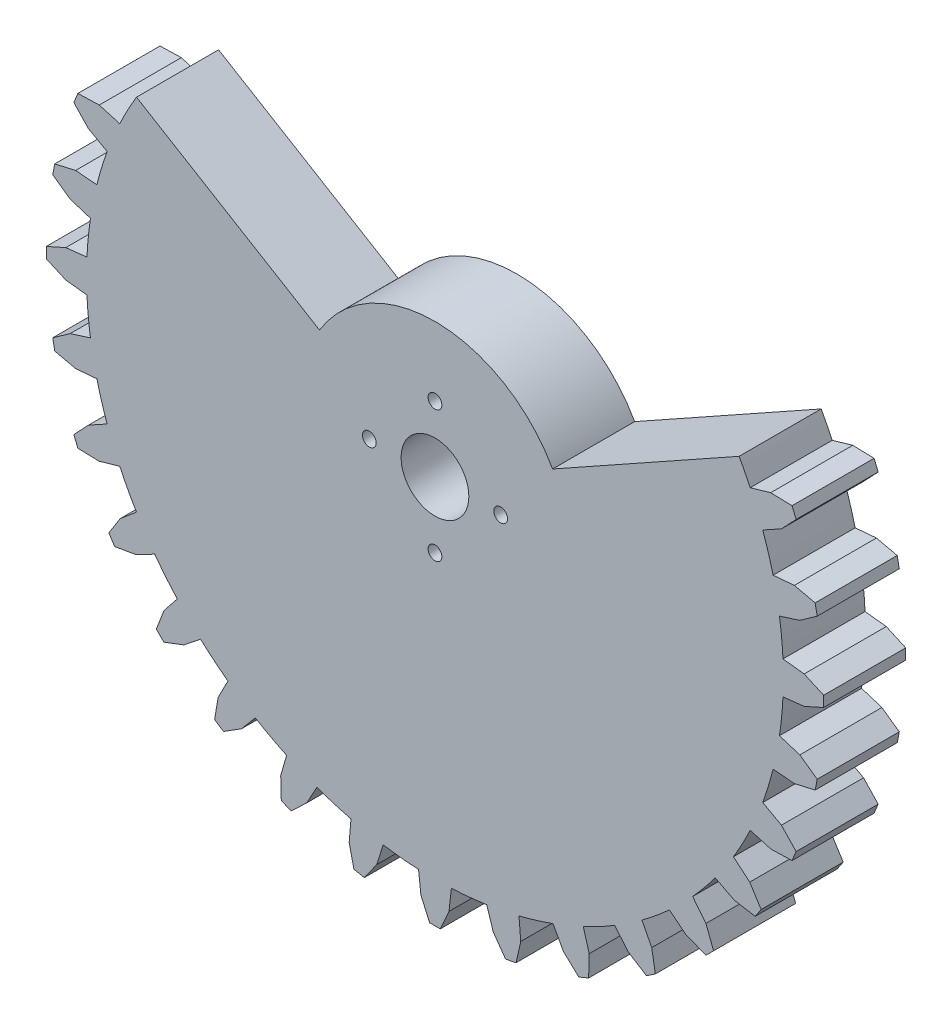
from build123d import *

# Parameters (mm, degrees)
BOSS_EXTRU_1_DEPTH      = 10
ESQUISSE2_R             = 0.838714544
ESQUISSE2_R_2           = 4.125
ENL_V_MAT_EXTRU_3_DEPTH = 10
ENL_V_MAT_EXTRU_6_DEPTH = 10


with BuildPart() as part:
    # Esquisse1 → Boss.-Extru.1 (new body)
    with BuildSketch(Plane.XY):
        with BuildLine():
            Line((-2, 42.397854014), (-1.710180776, 44.981650604))
            Line((-1.710180776, 44.981650604), (-0.65, 47.355680242))
            Line((-0.65, 47.355680242), (0.65, 47.355680242))
            Line((0.65, 47.355680242), (1.710180776, 44.981650604))
            Line((1.710180776, 44.981650604), (2, 42.397854014))
            ThreePointArc((2, 42.397854014), (4.160337521, 42.240615724), (6.309840432, 41.973371782))
            Line((6.309840432, 41.973371782), (7.098164569, 44.450980519))
            Line((7.098164569, 44.450980519), (8.601124475, 46.572562834))
            Line((8.601124475, 46.572562834), (9.87614534, 46.318945415))
            Line((9.87614534, 46.318945415), (10.452804833, 43.783701082))
            Line((10.452804833, 43.783701082), (10.232981553, 41.193010494))
            ThreePointArc((10.232981553, 41.193010494), (12.321133126, 40.61733255), (14.377197234, 39.935876411))
            Line((14.377197234, 39.935876411), (15.63373143, 42.212084181))
            Line((15.63373143, 42.212084181), (17.521712561, 43.999687955))
            Line((17.521712561, 43.999687955), (18.722755953, 43.502199493))
            Line((18.722755953, 43.502199493), (18.793733463, 40.903168482))
            Line((18.793733463, 40.903168482), (18.072715364, 38.405142681))
            ThreePointArc((18.072715364, 38.405142681), (20.008434495, 37.433148065), (21.89204641, 36.363667706))
            Line((21.89204641, 36.363667706), (23.568502761, 38.351001121))
            Line((23.568502761, 38.351001121), (25.768951059, 39.735929742))
            Line((25.768951059, 39.735929742), (26.849861555, 39.01368844))
            Line((26.849861555, 39.01368844), (26.412429455, 36.450750056))
            Line((26.412429455, 36.450750056), (25.217924859, 34.141386774))
            ThreePointArc((25.217924859, 34.141386774), (26.926822946, 32.810428693), (28.565596519, 31.394023643))
            Line((28.565596519, 31.394023643), (30.597549747, 33.016110595))
            Line((30.597549747, 33.016110595), (33.025903219, 33.945142034))
            Line((33.025903219, 33.945142034), (33.945142034, 33.025903219))
            Line((33.945142034, 33.025903219), (33.016110595, 30.597549747))
            Line((33.016110595, 30.597549747), (31.394023643, 28.565596519))
            ThreePointArc((31.394023643, 28.565596519), (32.810428693, 26.926822946), (34.141386774, 25.217924859))
            Line((34.141386774, 25.217924859), (36.450750056, 26.412429455))
            Line((36.450750056, 26.412429455), (39.01368844, 26.849861555))
            Line((39.01368844, 26.849861555), (39.735929742, 25.768951059))
            Line((39.735929742, 25.768951059), (38.351001121, 23.568502761))
            Line((38.351001121, 23.568502761), (36.363667706, 21.89204641))
            ThreePointArc((36.363667706, 21.89204641), (37.433148065, 20.008434495), (38.405142681, 18.072715364))
            Line((38.405142681, 18.072715364), (40.903168482, 18.793733463))
            Line((40.903168482, 18.793733463), (43.502199493, 18.722755953))
            Line((43.502199493, 18.722755953), (43.999687955, 17.521712561))
            Line((43.999687955, 17.521712561), (42.212084181, 15.63373143))
            Line((42.212084181, 15.63373143), (39.935876411, 14.377197234))
            ThreePointArc((39.935876411, 14.377197234), (40.61733255, 12.321133126), (41.193010494, 10.232981553))
            Line((41.193010494, 10.232981553), (43.783701082, 10.452804833))
            Line((43.783701082, 10.452804833), (46.318945415, 9.87614534))
            Line((46.318945415, 9.87614534), (46.572562834, 8.601124475))
            Line((46.572562834, 8.601124475), (44.450980519, 7.098164569))
            Line((44.450980519, 7.098164569), (41.973371782, 6.309840432))
            ThreePointArc((41.973371782, 6.309840432), (42.240615724, 4.160337521), (42.397854014, 2))
            Line((42.397854014, 2), (44.981650604, 1.710180776))
            Line((44.981650604, 1.710180776), (47.355680242, 0.65))
            Line((47.355680242, 0.65), (47.355680242, -0.65))
            Line((47.355680242, -0.65), (44.981650604, -1.710180776))
            Line((44.981650604, -1.710180776), (42.397854014, -2))
            ThreePointArc((42.397854014, -2), (42.240615724, -4.160337521), (41.973371782, -6.309840432))
            Line((41.973371782, -6.309840432), (44.450980519, -7.098164569))
            Line((44.450980519, -7.098164569), (46.572562834, -8.601124475))
            Line((46.572562834, -8.601124475), (46.318945415, -9.87614534))
            Line((46.318945415, -9.87614534), (43.783701082, -10.452804833))
            Line((43.783701082, -10.452804833), (41.193010494, -10.232981553))
            ThreePointArc((41.193010494, -10.232981553), (40.61733255, -12.321133126), (39.935876411, -14.377197234))
            Line((39.935876411, -14.377197234), (42.212084181, -15.63373143))
            Line((42.212084181, -15.63373143), (43.999687955, -17.521712561))
            Line((43.999687955, -17.521712561), (43.502199493, -18.722755953))
            Line((43.502199493, -18.722755953), (40.903168482, -18.793733463))
            Line((40.903168482, -18.793733463), (38.405142681, -18.072715364))
            ThreePointArc((38.405142681, -18.072715364), (37.433148065, -20.008434495), (36.363667706, -21.89204641))
            Line((36.363667706, -21.89204641), (38.351001121, -23.568502761))
            Line((38.351001121, -23.568502761), (39.735929742, -25.768951059))
            Line((39.735929742, -25.768951059), (39.01368844, -26.849861555))
            Line((39.01368844, -26.849861555), (36.450750056, -26.412429455))
            Line((36.450750056, -26.412429455), (34.141386774, -25.217924859))
            ThreePointArc((34.141386774, -25.217924859), (32.810428693, -26.926822946), (31.394023643, -28.565596519))
            Line((31.394023643, -28.565596519), (33.016110595, -30.597549747))
            Line((33.016110595, -30.597549747), (33.945142034, -33.025903219))
            Line((33.945142034, -33.025903219), (33.025903219, -33.945142034))
            Line((33.025903219, -33.945142034), (30.597549747, -33.016110595))
            Line((30.597549747, -33.016110595), (28.565596519, -31.394023643))
            ThreePointArc((28.565596519, -31.394023643), (26.926822946, -32.810428693), (25.217924859, -34.141386774))
            Line((25.217924859, -34.141386774), (26.412429455, -36.450750056))
            Line((26.412429455, -36.450750056), (26.849861555, -39.01368844))
            Line((26.849861555, -39.01368844), (25.768951059, -39.735929742))
            Line((25.768951059, -39.735929742), (23.568502761, -38.351001121))
            Line((23.568502761, -38.351001121), (21.89204641, -36.363667706))
            ThreePointArc((21.89204641, -36.363667706), (20.008434495, -37.433148065), (18.072715364, -38.405142681))
            Line((18.072715364, -38.405142681), (18.793733463, -40.903168482))
            Line((18.793733463, -40.903168482), (18.722755953, -43.502199493))
            Line((18.722755953, -43.502199493), (17.521712561, -43.999687955))
            Line((17.521712561, -43.999687955), (15.63373143, -42.212084181))
            Line((15.63373143, -42.212084181), (14.377197234, -39.935876411))
            ThreePointArc((14.377197234, -39.935876411), (12.321133126, -40.61733255), (10.232981553, -41.193010494))
            Line((10.232981553, -41.193010494), (10.452804833, -43.783701082))
            Line((10.452804833, -43.783701082), (9.87614534, -46.318945415))
            Line((9.87614534, -46.318945415), (8.601124475, -46.572562834))
            Line((8.601124475, -46.572562834), (7.098164569, -44.450980519))
            Line((7.098164569, -44.450980519), (6.309840432, -41.973371782))
            ThreePointArc((6.309840432, -41.973371782), (4.160337521, -42.240615724), (2, -42.397854014))
            Line((2, -42.397854014), (1.710180776, -44.981650604))
            Line((1.710180776, -44.981650604), (0.65, -47.355680242))
            Line((0.65, -47.355680242), (-0.65, -47.355680242))
            Line((-0.65, -47.355680242), (-1.710180776, -44.981650604))
            Line((-1.710180776, -44.981650604), (-2, -42.397854014))
            ThreePointArc((-2, -42.397854014), (-4.160337521, -42.240615724), (-6.309840432, -41.973371782))
            Line((-6.309840432, -41.973371782), (-7.098164569, -44.450980519))
            Line((-7.098164569, -44.450980519), (-8.601124475, -46.572562834))
            Line((-8.601124475, -46.572562834), (-9.87614534, -46.318945415))
            Line((-9.87614534, -46.318945415), (-10.452804833, -43.783701082))
            Line((-10.452804833, -43.783701082), (-10.232981553, -41.193010494))
            ThreePointArc((-10.232981553, -41.193010494), (-12.321133126, -40.61733255), (-14.377197234, -39.935876411))
            Line((-14.377197234, -39.935876411), (-15.63373143, -42.212084181))
            Line((-15.63373143, -42.212084181), (-17.521712561, -43.999687955))
            Line((-17.521712561, -43.999687955), (-18.722755953, -43.502199493))
            Line((-18.722755953, -43.502199493), (-18.793733463, -40.903168482))
            Line((-18.793733463, -40.903168482), (-18.072715364, -38.405142681))
            ThreePointArc((-18.072715364, -38.405142681), (-20.008434495, -37.433148065), (-21.89204641, -36.363667706))
            Line((-21.89204641, -36.363667706), (-23.568502761, -38.351001121))
            Line((-23.568502761, -38.351001121), (-25.768951059, -39.735929742))
            Line((-25.768951059, -39.735929742), (-26.849861555, -39.01368844))
            Line((-26.849861555, -39.01368844), (-26.412429455, -36.450750056))
            Line((-26.412429455, -36.450750056), (-25.217924859, -34.141386774))
            ThreePointArc((-25.217924859, -34.141386774), (-26.926822946, -32.810428693), (-28.565596519, -31.394023643))
            Line((-28.565596519, -31.394023643), (-30.597549747, -33.016110595))
            Line((-30.597549747, -33.016110595), (-33.025903219, -33.945142034))
            Line((-33.025903219, -33.945142034), (-33.945142034, -33.025903219))
            Line((-33.945142034, -33.025903219), (-33.016110595, -30.597549747))
            Line((-33.016110595, -30.597549747), (-31.394023643, -28.565596519))
            ThreePointArc((-31.394023643, -28.565596519), (-32.810428693, -26.926822946), (-34.141386774, -25.217924859))
            Line((-34.141386774, -25.217924859), (-36.450750056, -26.412429455))
            Line((-36.450750056, -26.412429455), (-39.01368844, -26.849861555))
            Line((-39.01368844, -26.849861555), (-39.735929742, -25.768951059))
            Line((-39.735929742, -25.768951059), (-38.351001121, -23.568502761))
            Line((-38.351001121, -23.568502761), (-36.363667706, -21.89204641))
            ThreePointArc((-36.363667706, -21.89204641), (-37.433148065, -20.008434495), (-38.405142681, -18.072715364))
            Line((-38.405142681, -18.072715364), (-40.903168482, -18.793733463))
            Line((-40.903168482, -18.793733463), (-43.502199493, -18.722755953))
            Line((-43.502199493, -18.722755953), (-43.999687955, -17.521712561))
            Line((-43.999687955, -17.521712561), (-42.212084181, -15.63373143))
            Line((-42.212084181, -15.63373143), (-39.935876411, -14.377197234))
            ThreePointArc((-39.935876411, -14.377197234), (-40.61733255, -12.321133126), (-41.193010494, -10.232981553))
            Line((-41.193010494, -10.232981553), (-43.783701082, -10.452804833))
            Line((-43.783701082, -10.452804833), (-46.318945415, -9.87614534))
            Line((-46.318945415, -9.87614534), (-46.572562834, -8.601124475))
            Line((-46.572562834, -8.601124475), (-44.450980519, -7.098164569))
            Line((-44.450980519, -7.098164569), (-41.973371782, -6.309840432))
            ThreePointArc((-41.973371782, -6.309840432), (-42.240615724, -4.160337521), (-42.397854014, -2))
            Line((-42.397854014, -2), (-44.981650604, -1.710180776))
            Line((-44.981650604, -1.710180776), (-47.355680242, -0.65))
            Line((-47.355680242, -0.65), (-47.355680242, 0.65))
            Line((-47.355680242, 0.65), (-44.981650604, 1.710180776))
            Line((-44.981650604, 1.710180776), (-42.397854014, 2))
            ThreePointArc((-42.397854014, 2), (-42.240615724, 4.160337521), (-41.973371782, 6.309840432))
            Line((-41.973371782, 6.309840432), (-44.450980519, 7.098164569))
            Line((-44.450980519, 7.098164569), (-46.572562834, 8.601124475))
            Line((-46.572562834, 8.601124475), (-46.318945415, 9.87614534))
            Line((-46.318945415, 9.87614534), (-43.783701082, 10.452804833))
            Line((-43.783701082, 10.452804833), (-41.193010494, 10.232981553))
            ThreePointArc((-41.193010494, 10.232981553), (-40.61733255, 12.321133126), (-39.935876411, 14.377197234))
            Line((-39.935876411, 14.377197234), (-42.212084181, 15.63373143))
            Line((-42.212084181, 15.63373143), (-43.999687955, 17.521712561))
            Line((-43.999687955, 17.521712561), (-43.502199493, 18.722755953))
            Line((-43.502199493, 18.722755953), (-40.903168482, 18.793733463))
            Line((-40.903168482, 18.793733463), (-38.405142681, 18.072715364))
            ThreePointArc((-38.405142681, 18.072715364), (-37.433148065, 20.008434495), (-36.363667706, 21.89204641))
            Line((-36.363667706, 21.89204641), (-38.351001121, 23.568502761))
            Line((-38.351001121, 23.568502761), (-39.735929742, 25.768951059))
            Line((-39.735929742, 25.768951059), (-39.01368844, 26.849861555))
            Line((-39.01368844, 26.849861555), (-36.450750056, 26.412429455))
            Line((-36.450750056, 26.412429455), (-34.141386774, 25.217924859))
            ThreePointArc((-34.141386774, 25.217924859), (-32.810428693, 26.926822946), (-31.394023643, 28.565596519))
            Line((-31.394023643, 28.565596519), (-33.016110595, 30.597549747))
            Line((-33.016110595, 30.597549747), (-33.945142034, 33.025903219))
            Line((-33.945142034, 33.025903219), (-33.025903219, 33.945142034))
            Line((-33.025903219, 33.945142034), (-30.597549747, 33.016110595))
            Line((-30.597549747, 33.016110595), (-28.565596519, 31.394023643))
            ThreePointArc((-28.565596519, 31.394023643), (-26.926822946, 32.810428693), (-25.217924859, 34.141386774))
            Line((-25.217924859, 34.141386774), (-26.412429455, 36.450750056))
            Line((-26.412429455, 36.450750056), (-26.849861555, 39.01368844))
            Line((-26.849861555, 39.01368844), (-25.768951059, 39.735929742))
            Line((-25.768951059, 39.735929742), (-23.568502761, 38.351001121))
            Line((-23.568502761, 38.351001121), (-21.89204641, 36.363667706))
            ThreePointArc((-21.89204641, 36.363667706), (-20.008434495, 37.433148065), (-18.072715364, 38.405142681))
            Line((-18.072715364, 38.405142681), (-18.793733463, 40.903168482))
            Line((-18.793733463, 40.903168482), (-18.722755953, 43.502199493))
            Line((-18.722755953, 43.502199493), (-17.521712561, 43.999687955))
            Line((-17.521712561, 43.999687955), (-15.63373143, 42.212084181))
            Line((-15.63373143, 42.212084181), (-14.377197234, 39.935876411))
            ThreePointArc((-14.377197234, 39.935876411), (-12.321133126, 40.61733255), (-10.232981553, 41.193010494))
            Line((-10.232981553, 41.193010494), (-10.452804833, 43.783701082))
            Line((-10.452804833, 43.783701082), (-9.87614534, 46.318945415))
            Line((-9.87614534, 46.318945415), (-8.601124475, 46.572562834))
            Line((-8.601124475, 46.572562834), (-7.098164569, 44.450980519))
            Line((-7.098164569, 44.450980519), (-6.309840432, 41.973371782))
            ThreePointArc((-6.309840432, 41.973371782), (-4.160337521, 42.240615724), (-2, 42.397854014))
        make_face()
    extrude(amount=BOSS_EXTRU_1_DEPTH)

    # Esquisse2 → Enlèv. mat.-Extru.3 (cut)
    with BuildSketch(Plane.XY.offset(10)):
        with Locations((0, 8)):
            Circle(ESQUISSE2_R)
        Circle(ESQUISSE2_R_2)
        with Locations((8, 0)):
            Circle(ESQUISSE2_R)
        with Locations((0, -8)):
            Circle(ESQUISSE2_R)
        with Locations((-8, 0)):
            Circle(ESQUISSE2_R)
    extrude(amount=-ENL_V_MAT_EXTRU_3_DEPTH, mode=Mode.SUBTRACT)

    # Esquisse3 → Enlèv. mat.-Extru.6 (cut)
    with BuildSketch(Plane.XY.offset(10)):
        with BuildLine():
            Line((-36.363667706, 21.89204641), (-14.065404068, 8.467805864))
            ThreePointArc((-14.065404068, 8.467805864), (0.265065614, 16.415513028), (14.331463821, 8.009274155))
            Line((14.331463821, 8.009274155), (37.051519146, 20.706592042))
            Line((37.051519146, 20.706592042), (45.6183096, 25.494223943))
            ThreePointArc((45.6183096, 25.494223943), (0.922129514, 57.107479129), (-44.77141801, 26.953770693))
            Line((-44.77141801, 26.953770693), (-36.363667706, 21.89204641))
        make_face()
    extrude(amount=-ENL_V_MAT_EXTRU_6_DEPTH, mode=Mode.SUBTRACT)


solid = part.part
